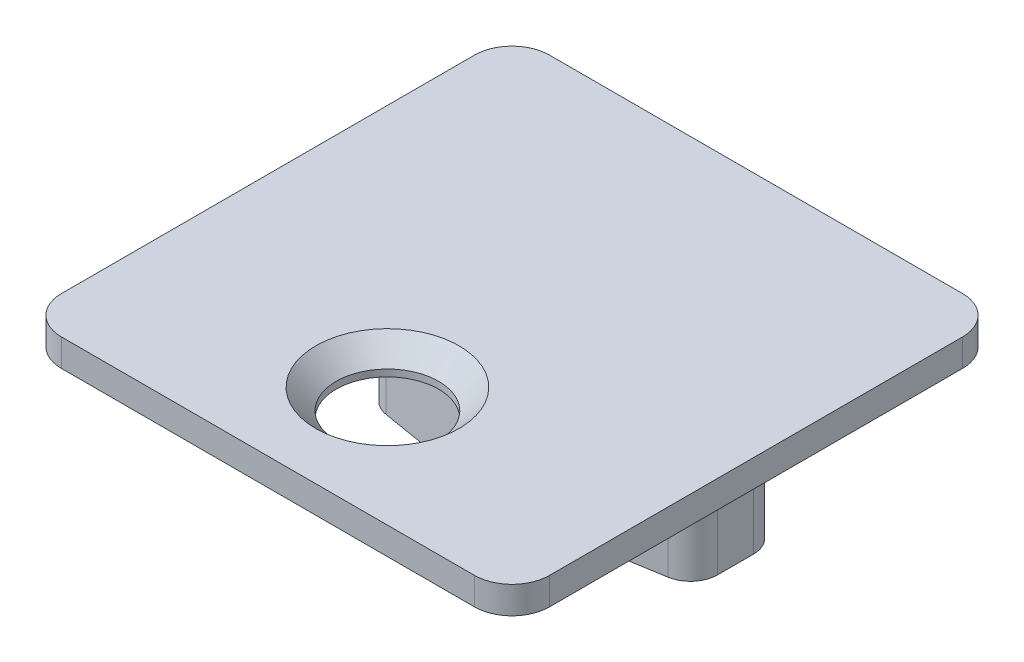
from build123d import *

# Parameters (mm, degrees)
SKIZZE1_R                       = 3.75
AUFSATZ_LINEAR_AUSTRAGEN1_DEPTH = 2
AUFSATZ_LINEAR_AUSTRAGEN2_DEPTH = 10
VERRUNDUNG1_R                   = 2
FASE2_SIZE                      = 1.5


with BuildPart() as part:
    # Skizze1 → Aufsatz-Linear austragen1 (new body)
    with BuildSketch(Plane(origin=(0, 0, 0), x_dir=(1, 0, 0), z_dir=(0, 1, 0))):
        with BuildLine():
            Line((15.125, 17.875), (-15.125, 17.875))
            ThreePointArc((-15.125, 17.875), (-17.069543648, 17.069543648), (-17.875, 15.125))
            Line((-17.875, 15.125), (-17.875, -15.125))
            ThreePointArc((-17.875, -15.125), (-17.069543648, -17.069543648), (-15.125, -17.875))
            Line((-15.125, -17.875), (15.125, -17.875))
            ThreePointArc((15.125, -17.875), (17.069543648, -17.069543648), (17.875, -15.125))
            Line((17.875, -15.125), (17.875, 15.125))
            ThreePointArc((17.875, 15.125), (17.069543648, 17.069543648), (15.125, 17.875))
        make_face()
        with Locations((0, -9.125)):
            Circle(SKIZZE1_R, mode=Mode.SUBTRACT)
    extrude(amount=AUFSATZ_LINEAR_AUSTRAGEN1_DEPTH)

    # Skizze1<6> → Aufsatz-Linear austragen2 (add)
    with BuildSketch(Plane(origin=(0, 0, 0), x_dir=(1, 0, 0), z_dir=(0, 1, 0))):
        Polygon((12, 7.375), (0, 9.375), (-12, 7.375), (-12, 1.375), (0, -0.625), (12, 1.375), align=None)
        Polygon((-10.5, 2.645690633), (-10.5, 6.104309367), (0, 7.854309367), (10.5, 6.104309367), (10.5, 2.645690633), (0, 0.895690633), align=None, mode=Mode.SUBTRACT)
    extrude(amount=-AUFSATZ_LINEAR_AUSTRAGEN2_DEPTH)

    # Verrundung1
    verrundung1_edges = [part.edges().sort_by_distance(p)[0] for p in [
        (0, -5, -9.375),
        (0, -5, 0.625),
        (12, -5, -1.375),
        (12, -5, -7.375),
        (-12, -5, -1.375),
        (-12, -5, -7.375),
    ]]
    fillet(verrundung1_edges, radius=VERRUNDUNG1_R)

    # Fase2
    fase2_edges = [part.edges().sort_by_distance(p)[0] for p in [
        (-3.75, 2, 9.125),
    ]]
    chamfer(fase2_edges, length=FASE2_SIZE)


solid = part.part
